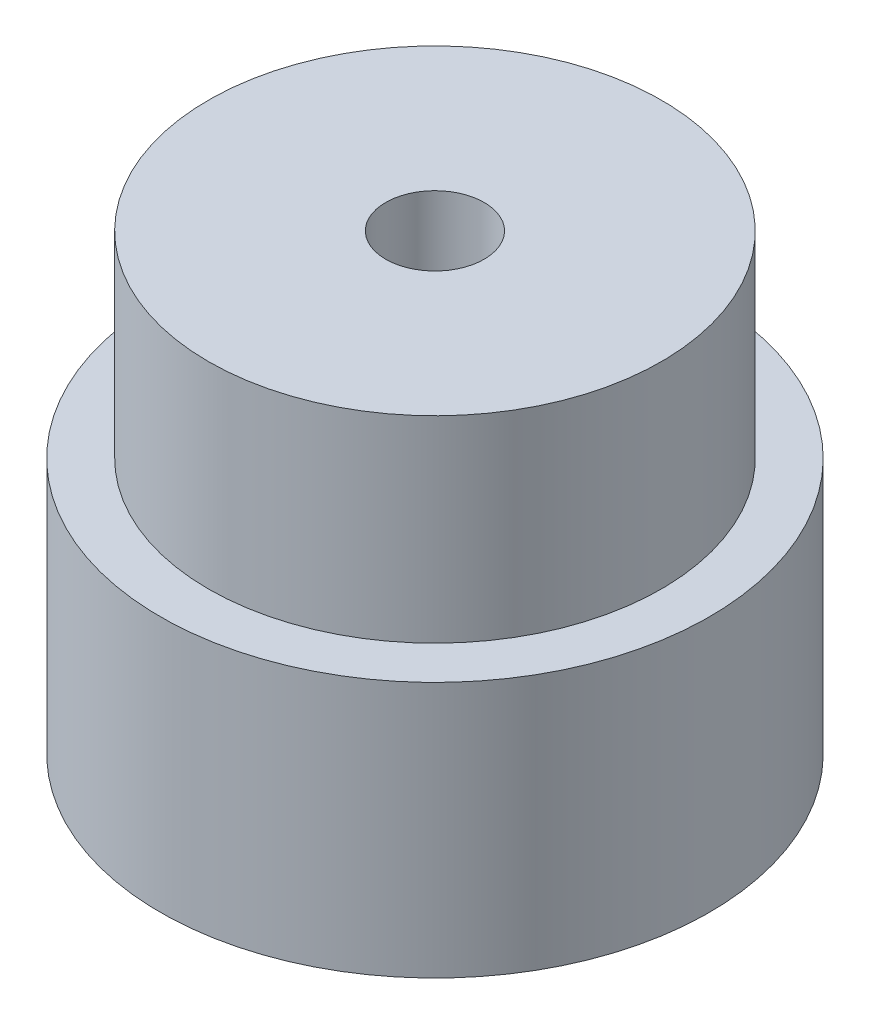
from build123d import *

# Parameters (mm, degrees)
SKETCH_1_R          = 13.94
EXTRUDE_1_DEPTH     = 13
SKETCH_2_R          = 11.5
EXTRUDE_2_DEPTH     = 10
SKETCH_3_R          = 2.5
CUT_EXTRUDE_1_DEPTH = 30


with BuildPart() as part:
    # 草图1 → 凸台-拉伸1 (new body)
    with BuildSketch(Plane(origin=(0, 0, 0), x_dir=(1, 0, 0), z_dir=(0, 1, 0))):
        with Locations(Location((0, 0, 0), (0, 0, 90))):
            Circle(SKETCH_1_R)
    extrude(amount=EXTRUDE_1_DEPTH)

    # 草图2 → 凸台-拉伸2 (add)
    with BuildSketch(Plane(origin=(0, 13, 0), x_dir=(1, 0, 0), z_dir=(0, 1, 0))):
        with Locations(Location((0, 0, 0), (0, 0, 270))):
            Circle(SKETCH_2_R)
    extrude(amount=EXTRUDE_2_DEPTH)

    # 草图3 → 切除-拉伸1 (cut)
    with BuildSketch(Plane(origin=(0, 23, 0), x_dir=(1, 0, 0), z_dir=(0, 1, 0))):
        with Locations(Location((0, 0, 0), (0, 0, 270))):
            Circle(SKETCH_3_R)
    extrude(amount=-CUT_EXTRUDE_1_DEPTH, mode=Mode.SUBTRACT)


solid = part.part
